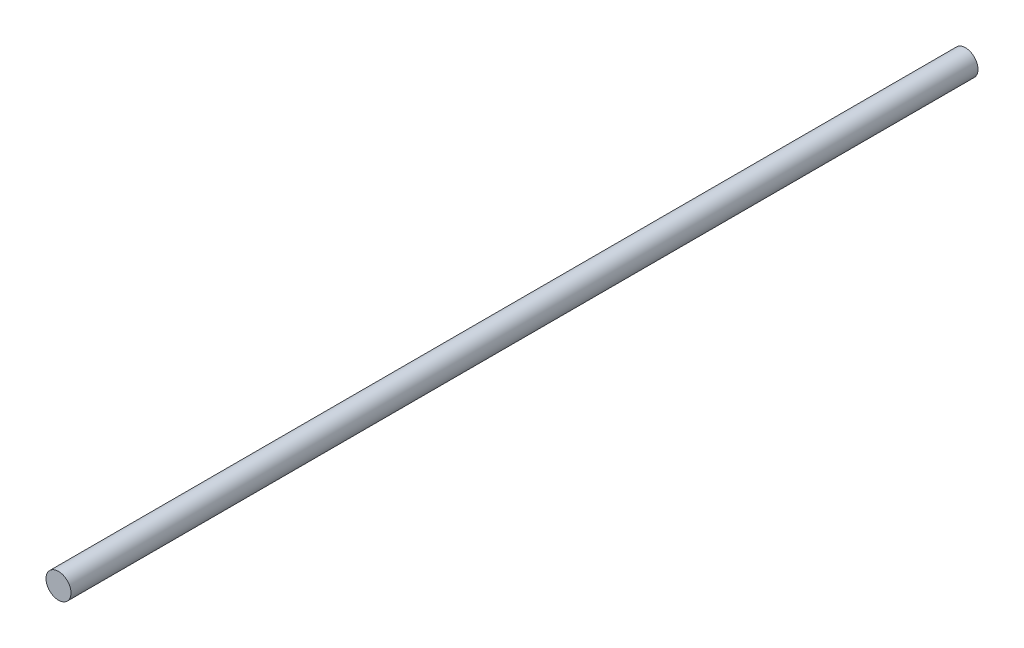
from build123d import *

# Parameters (mm, degrees)
SKETCH3_R           = 4
BOSS_EXTRUDE1_DEPTH = 145


with BuildPart() as part:
    # Sketch3 → Boss-Extrude1 (new, symmetric)
    with BuildSketch(Plane.XY):
        Circle(SKETCH3_R)
    extrude(amount=BOSS_EXTRUDE1_DEPTH, both=True)


solid = part.part
